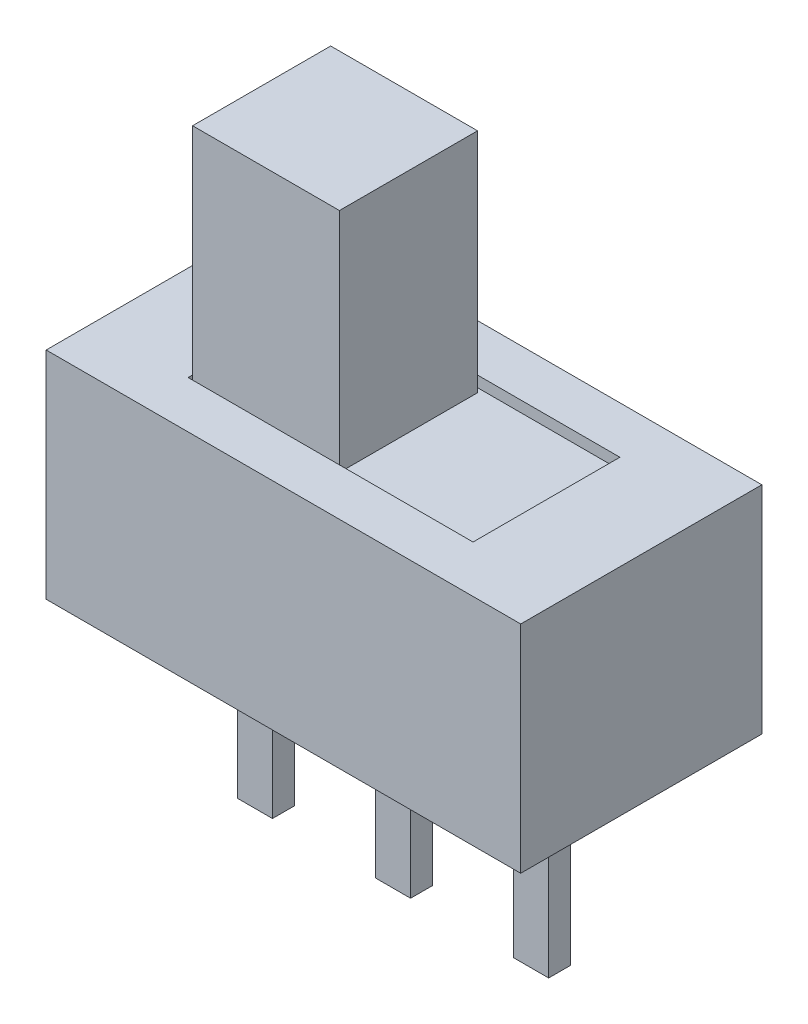
from build123d import *

# Parameters (mm, degrees)
SKETCH1_W           = 10.9982
SKETCH1_H           = 5.588
BOSS_EXTRUDE1_DEPTH = 5.0038
SKETCH2_W           = 6.604
SKETCH2_H           = 3.4036
CUT_EXTRUDE1_DEPTH  = 0.254
SKETCH3_W           = 3.4036
SKETCH3_H           = 3.2004
BOSS_EXTRUDE2_DEPTH = 5.2578
SKETCH4_W           = 0.8128
SKETCH4_H           = 0.508
BOSS_EXTRUDE3_DEPTH = 4.318
LPATTERN1_COUNT     = 2
LPATTERN1_PITCH     = 3.2004
LPATTERN1_COL_COUNT = 2
LPATTERN1_COL_PITCH = 3.2004


with BuildPart() as part:
    # Sketch1 → Boss-Extrude1 (new body)
    with BuildSketch(Plane(origin=(0, 0, 0), x_dir=(1, 0, 0), z_dir=(0, 1, 0))):
        Rectangle(SKETCH1_W, SKETCH1_H)
    extrude(amount=BOSS_EXTRUDE1_DEPTH)

    # Sketch2 → Cut-Extrude1 (cut)
    with BuildSketch(Plane(origin=(0, 5.0038, 0), x_dir=(1, 0, 0), z_dir=(0, 1, 0))):
        Rectangle(SKETCH2_W, SKETCH2_H)
    extrude(amount=-CUT_EXTRUDE1_DEPTH, mode=Mode.SUBTRACT)

    # Sketch3 → Boss-Extrude2 (add)
    with BuildSketch(Plane(origin=(0, 4.7498, 0), x_dir=(1, 0, 0), z_dir=(0, 1, 0))):
        with Locations((-1.59766, 0)):
            Rectangle(SKETCH3_W, SKETCH3_H)
    extrude(amount=BOSS_EXTRUDE2_DEPTH)

    # Sketch4 → Boss-Extrude3 (add)
    with BuildSketch(Plane.XZ):
        Rectangle(SKETCH4_W, SKETCH4_H)
    boss_extrude3 = extrude(amount=BOSS_EXTRUDE3_DEPTH)

    # LPattern1: Boss-Extrude3 ×2
    with Locations(*[(i * LPATTERN1_PITCH, 0, 0) for i in range(1, LPATTERN1_COUNT)]):
        add(boss_extrude3)

    # LPattern1 col: Boss-Extrude3 ×2
    with Locations(*[(-i * LPATTERN1_COL_PITCH, 0, 0) for i in range(1, LPATTERN1_COL_COUNT)]):
        add(boss_extrude3)


solid = part.part
